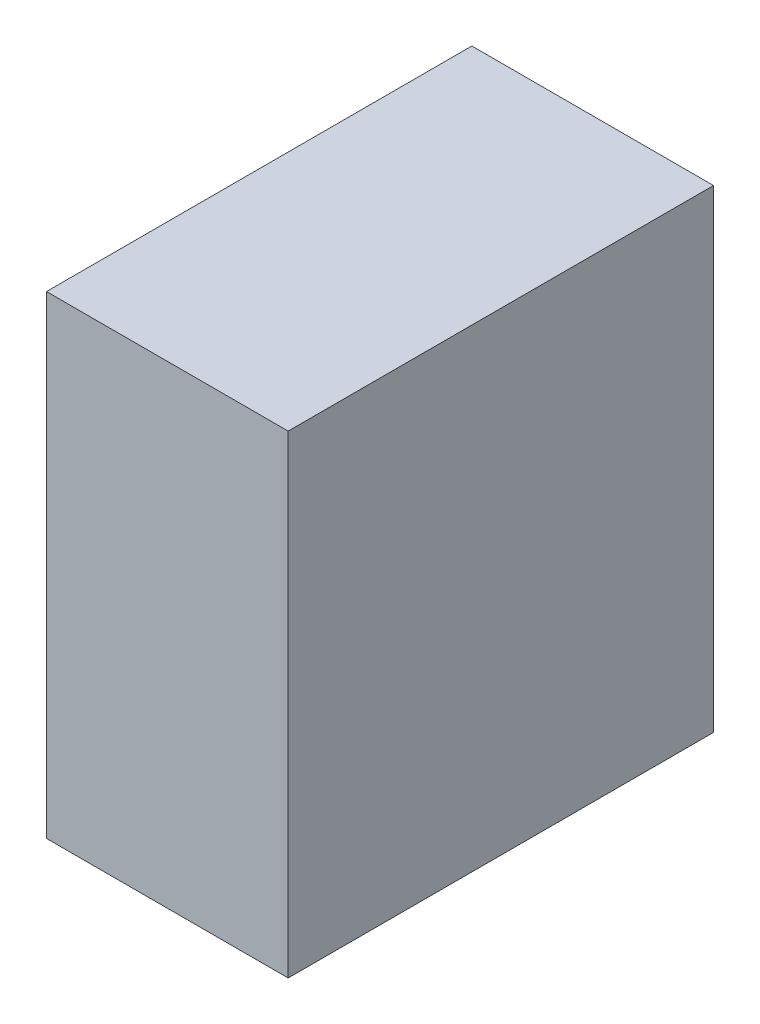
from build123d import *

# Parameters (mm, degrees)
SKETCH1_W           = 220
SKETCH1_H           = 245
BOSS_EXTRUDE1_DEPTH = 125


with BuildPart() as part:
    # Sketch1 → Boss-Extrude1 (new body)
    with BuildSketch(Plane(origin=(0, 0, 0), x_dir=(0, 0, -1), z_dir=(1, 0, 0))):
        Rectangle(SKETCH1_W, SKETCH1_H)
    extrude(amount=BOSS_EXTRUDE1_DEPTH)


solid = part.part
